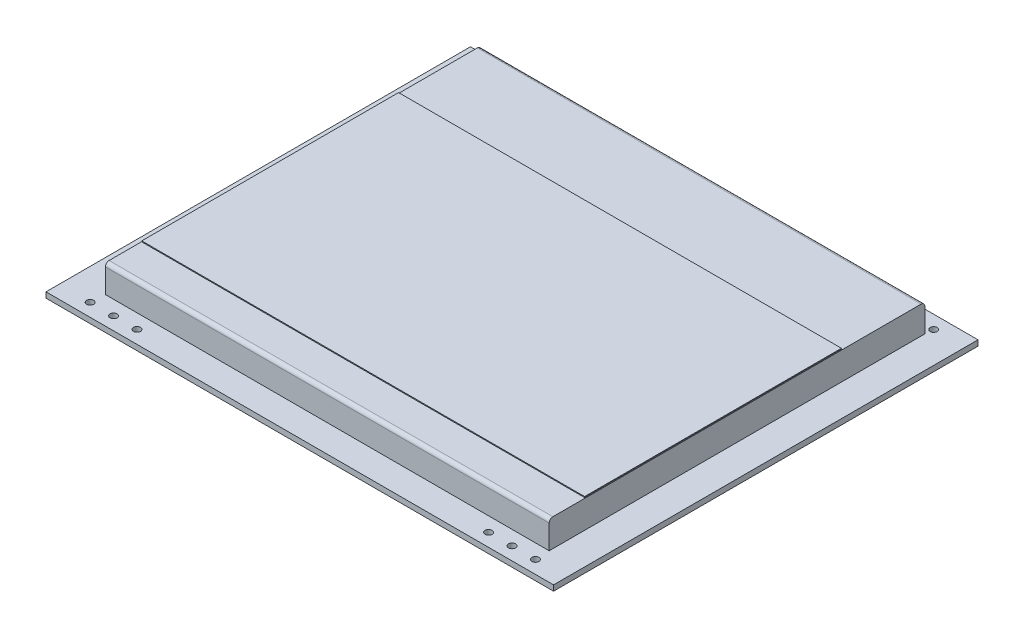
from build123d import *

# Parameters (mm, degrees)
BOSS_EXTRU_1_DEPTH         = 0.6
ESQUISSE3_W                = 48.088583049
ESQUISSE3_H                = 40.702531731
BOSS_EXTRU_2_DEPTH         = 3
CONG_1_R                   = 0.4
ESQUISSE4_W                = 47.99
ESQUISSE4_H                = 27.83
BOSS_EXTRU_3_DEPTH         = 0.1
ESQUISSE5_R                = 0.381
ENL_V_MAT_EXTRU_1_DEPTH    = 38.55059167
R_P_TITION_LIN_AIRE1_COUNT = 20
R_P_TITION_LIN_AIRE1_PITCH = 2.54
ESQUISSE7_R                = 0.381
ENL_V_MAT_EXTRU_3_DEPTH    = 38.435332241
R_P_TITION_LIN_AIRE2_COUNT = 3
R_P_TITION_LIN_AIRE2_PITCH = 2.54
ESQUISSE9_R                = 0.381
ENL_V_MAT_EXTRU_4_DEPTH    = 38.435332241
R_P_TITION_LIN_AIRE3_COUNT = 3
R_P_TITION_LIN_AIRE3_PITCH = 2.54


with BuildPart() as part:
    # cadre ecran → Boss.-Extru.1 (new body)
    with BuildSketch(Plane(origin=(0, 0, 0), x_dir=(1, 0, 0), z_dir=(0, 1, 0))):
        Polygon((0, -20.787329411), (27.5, -20.787329411), (27.5, 25.21), (-27.5, 25.21), (-27.5, -20.787329411), align=None)
    extrude(amount=BOSS_EXTRU_1_DEPTH)

    # Esquisse3 → Boss.-Extru.2 (add)
    with BuildSketch(Plane(origin=(0, 0.6, 0), x_dir=(1, 0, 0), z_dir=(0, 1, 0))):
        with Locations((0.023851228, 2.523244052)):
            Rectangle(ESQUISSE3_W, ESQUISSE3_H)
    extrude(amount=BOSS_EXTRU_2_DEPTH)

    # Congé1
    cong_1_edges = [part.edges().sort_by_distance(p)[0] for p in [
        (0.023851228, 3.6, 17.828021814),
        (0.023851228, 3.6, -22.874509917),
    ]]
    fillet(cong_1_edges, radius=CONG_1_R)

    # Esquisse4 → Boss.-Extru.3 (add)
    with BuildSketch(Plane(origin=(0, 3.6, 0), x_dir=(1, 0, 0), z_dir=(0, 1, 0))):
        Rectangle(ESQUISSE4_W, ESQUISSE4_H)
    extrude(amount=BOSS_EXTRU_3_DEPTH)

    # Esquisse5 → Enlèv. mat.-Extru.1 (cut, through all)
    with BuildSketch(Plane(origin=(-0.148451016, 0.6, 0.009042233), x_dir=(1, 0, 0), z_dir=(0, 1, 0))):
        with Locations(Location((-23.976340586, 23.783183719, 0), (0, 0, 270))):
            Circle(ESQUISSE5_R)
    enl_v_mat_extru_1 = extrude(amount=-ENL_V_MAT_EXTRU_1_DEPTH, mode=Mode.SUBTRACT)

    # Répétition linéaire1: Enlèv. mat.-Extru.1 ×20
    with Locations(*[(i * R_P_TITION_LIN_AIRE1_PITCH, 0, 0) for i in range(1, R_P_TITION_LIN_AIRE1_COUNT)]):
        add(enl_v_mat_extru_1, mode=Mode.SUBTRACT)

    # Esquisse7 → Enlèv. mat.-Extru.3 (cut, through all)
    with BuildSketch(Plane(origin=(0, 0.6, 0), x_dir=(1, 0, 0), z_dir=(0, 1, 0))):
        with Locations(Location((-24.124791601, -19.380242651, 0), (0, 0, 270))):
            Circle(ESQUISSE7_R)
    enl_v_mat_extru_3 = extrude(amount=-ENL_V_MAT_EXTRU_3_DEPTH, mode=Mode.SUBTRACT)

    # Répétition linéaire2: Enlèv. mat.-Extru.3 ×3
    with Locations(*[(i * R_P_TITION_LIN_AIRE2_PITCH, 0, 0) for i in range(1, R_P_TITION_LIN_AIRE2_COUNT)]):
        add(enl_v_mat_extru_3, mode=Mode.SUBTRACT)

    # Esquisse9 → Enlèv. mat.-Extru.4 (cut, through all)
    with BuildSketch(Plane(origin=(0, 0.6, 0), x_dir=(1, 0, 0), z_dir=(0, 1, 0))):
        with Locations(Location((24.135208399, -19.380242651, 0), (0, 0, 270))):
            Circle(ESQUISSE9_R)
    enl_v_mat_extru_4 = extrude(amount=-ENL_V_MAT_EXTRU_4_DEPTH, mode=Mode.SUBTRACT)

    # Répétition linéaire3: Enlèv. mat.-Extru.4 ×3
    with Locations(*[(-i * R_P_TITION_LIN_AIRE3_PITCH, 0, 0) for i in range(1, R_P_TITION_LIN_AIRE3_COUNT)]):
        add(enl_v_mat_extru_4, mode=Mode.SUBTRACT)


solid = part.part
